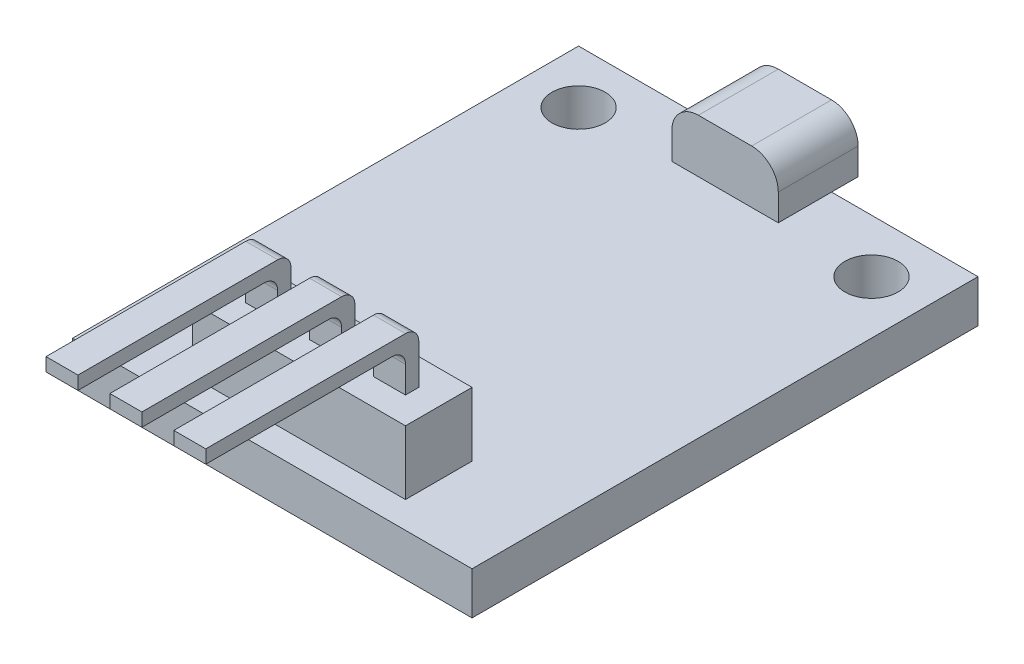
from build123d import *

# Parameters (mm, degrees)
ESBO_O1_W                = 15
ESBO_O1_H                = 19
ESBO_O1_R                = 1
RESSALTO_EXTRUS_O1_DEPTH = 1.6
ESBO_O3_W                = 4
ESBO_O3_H                = 3
RESSALTO_EXTRUS_O2_DEPTH = 2
FILETE1_R                = 1
ESBO_O4_W                = 8
ESBO_O4_H                = 2.5
RESSALTO_EXTRUS_O3_DEPTH = 2.4
RESSALTO_EXTRUS_O4_DEPTH = 3
CORTE_EXTRUS_O1_START    = -2
ESBO_O6_W                = 1.2
ESBO_O6_H                = 8
CORTE_EXTRUS_O1_DEPTH    = 2
ESBO_O7_W                = 6
ESBO_O7_H                = 14
RESSALTO_EXTRUS_O5_DEPTH = 1.5


with BuildPart() as part:
    # Esboço1 → Ressalto-extrusão1 (new body)
    with BuildSketch(Plane(origin=(0, 0, 0), x_dir=(1, 0, 0), z_dir=(0, 1, 0))):
        Rectangle(ESBO_O1_W, ESBO_O1_H)
        with Locations(Location((-5.5, 7.5, 0), (0, 0, 270))):
            Circle(ESBO_O1_R, mode=Mode.SUBTRACT)
        with Locations(Location((5.5, 7.5, 0), (0, 0, 270))):
            Circle(ESBO_O1_R, mode=Mode.SUBTRACT)
    extrude(amount=RESSALTO_EXTRUS_O1_DEPTH)

    # Esboço3 → Ressalto-extrusão2 (add)
    with BuildSketch(Plane(origin=(0, 1.6, 0), x_dir=(1, 0, 0), z_dir=(0, 1, 0))):
        with Locations((0, 9)):
            Rectangle(ESBO_O3_W, ESBO_O3_H)
    extrude(amount=RESSALTO_EXTRUS_O2_DEPTH)

    # Filete1
    filete1_edges = [part.edges().sort_by_distance(p)[0] for p in [
        (2, 3.6, -9),
        (-2, 3.6, -9),
    ]]
    fillet(filete1_edges, radius=FILETE1_R)

    # Esboço4 → Ressalto-extrusão3 (add)
    with BuildSketch(Plane(origin=(0, 1.6, 0), x_dir=(1, 0, 0), z_dir=(0, 1, 0))):
        with Locations((0, -7.25)):
            Rectangle(ESBO_O4_W, ESBO_O4_H)
    extrude(amount=RESSALTO_EXTRUS_O3_DEPTH)

    # Esboço5 → Ressalto-extrusão4 (add, symmetric)
    with BuildSketch(Plane(origin=(0, 0, 0), x_dir=(0, 0, -1), z_dir=(1, 0, 0))):
        with BuildLine():
            Line((-7.5, 4), (-7.5, 5))
            ThreePointArc((-7.5, 5), (-7.646446609, 5.353553391), (-8, 5.5))
            Line((-8, 5.5), (-15, 5.5))
            Line((-15, 5.5), (-15, 6))
            Line((-15, 6), (-7.5, 6))
            ThreePointArc((-7.5, 6), (-7.146446609, 5.853553391), (-7, 5.5))
            Line((-7, 5.5), (-7, 4))
            Line((-7, 4), (-7.5, 4))
        make_face()
    extrude(amount=RESSALTO_EXTRUS_O4_DEPTH, both=True)

    # Esboço6 → Corte-extrusão1 (cut)
    with BuildSketch(Plane(origin=(0, 6, 0), x_dir=(1, 0, 0), z_dir=(0, 1, 0)).offset(CORTE_EXTRUS_O1_START)):
        with Locations((-1.2, -11)):
            Rectangle(ESBO_O6_W, ESBO_O6_H)
        with Locations((1.2, -11)):
            Rectangle(ESBO_O6_W, ESBO_O6_H)
    extrude(amount=CORTE_EXTRUS_O1_DEPTH, mode=Mode.SUBTRACT)

    # Esboço7 → Ressalto-extrusão5 (add)
    with BuildSketch(Plane.XZ):
        with Locations((0, 1)):
            Rectangle(ESBO_O7_W, ESBO_O7_H)
    extrude(amount=RESSALTO_EXTRUS_O5_DEPTH)


solid = part.part
